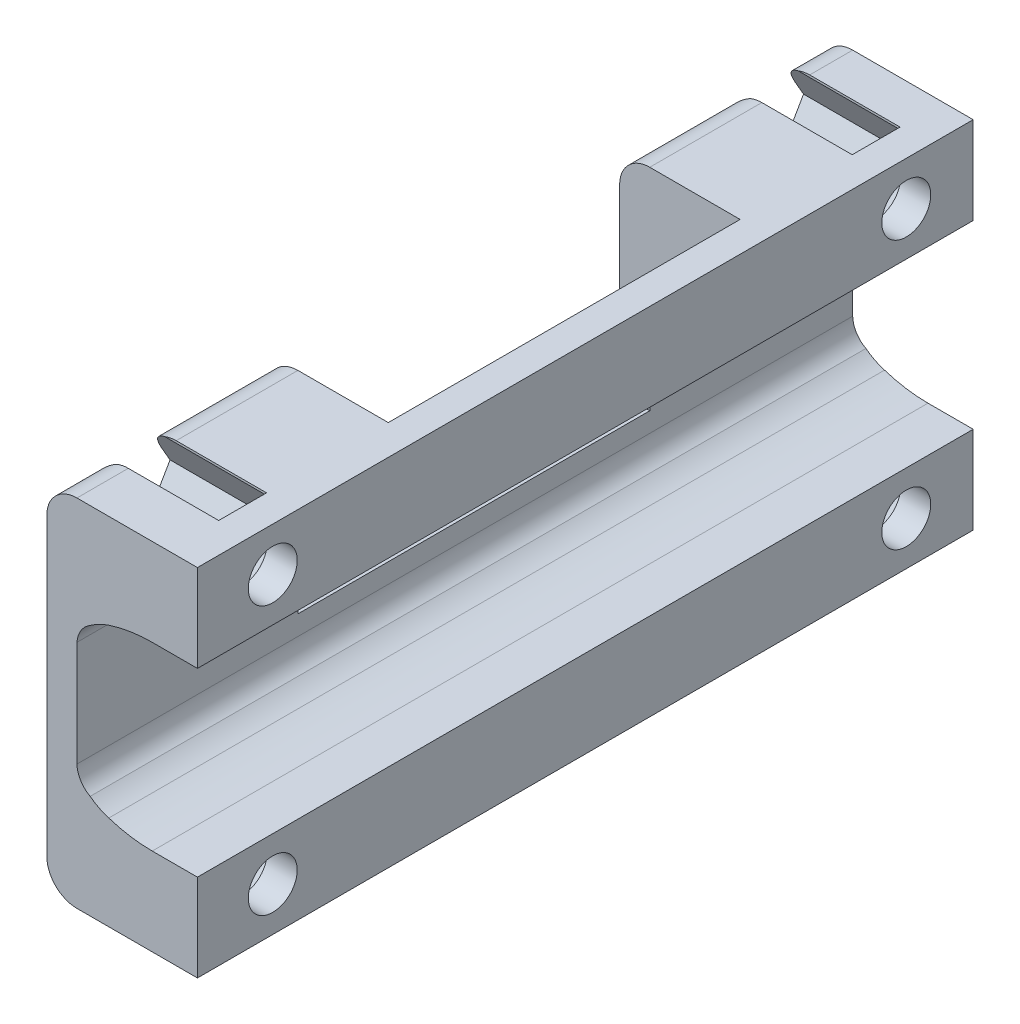
from build123d import *

# Parameters (mm, degrees)
SALIENTE_EXTRUIR1_DEPTH = 51.502837
CORTAR_EXTRUIR1_DEPTH   = 8
CROQUIS3_W              = 3.18
CROQUIS3_H              = 0.146039216
CORTAR_EXTRUIR3_DEPTH   = 8
CROQUIS4_W              = 23.359382497
CROQUIS4_H              = 14
CORTAR_EXTRUIR4_DEPTH   = 8
CORTAR_EXTRUIR5_START   = -51.502837
CORTAR_EXTRUIR5_DEPTH   = 51.502837
CROQUIS6_W              = 0.403846154
CROQUIS6_H              = 4.5
CORTAR_EXTRUIR6_DEPTH   = 1.5
CROQUIS7_R              = 1.625
CORTAR_EXTRUIR7_DEPTH   = 2


with BuildPart() as part:
    # Croquis1 → Saliente-Extruir1 (new body)
    with BuildSketch(Plane.XY):
        with BuildLine():
            Line((-16, 14), (-13, 14))
            Line((-13, 14), (-13, 8.2))
            Line((-13, 8.2), (-23, 8.2))
            Line((-23, 8.2), (-23, 31.8))
            Line((-23, 31.8), (-13, 31.8))
            Line((-13, 31.8), (-13, 26))
            Line((-13, 26), (-16, 26))
            ThreePointArc((-16, 26), (-17.460051117, 25.884841815), (-18.883995499, 25.542215094))
            ThreePointArc((-18.883995499, 25.542215094), (-19.527886573, 25.276055216), (-20.123234658, 24.91411951))
            ThreePointArc((-20.123234658, 24.91411951), (-20.731943688, 24.312663452), (-21, 23.5))
            Line((-21, 23.5), (-21, 16.5))
            ThreePointArc((-21, 16.5), (-20.754089234, 15.673606133), (-20.123234658, 15.08588049))
            ThreePointArc((-20.123234658, 15.08588049), (-19.534005924, 14.711871241), (-18.883995499, 14.457784906))
            ThreePointArc((-18.883995499, 14.457784906), (-17.460051117, 14.115158185), (-16, 14))
        make_face()
    extrude(amount=-SALIENTE_EXTRUIR1_DEPTH)

    # Croquis2 → Cortar-Extruir1 (cut)
    with BuildSketch(Plane.ZY.offset(23)):
        Polygon((-8.18, 28.9), (-6.59, 26.146039216), (-3.41, 26.146039216), (-1.82, 28.9), (-3.41, 31.653960784), (-6.59, 31.653960784), align=None)
        Polygon((-1.82, 11.1), (-3.41, 13.853960784), (-6.59, 13.853960784), (-8.18, 11.1), (-6.59, 8.346039216), (-3.41, 8.346039216), align=None)
        Polygon((-43.880216618, 28.9), (-45.470216618, 31.653960784), (-48.650216618, 31.653960784), (-50.240216618, 28.9), (-48.650216618, 26.146039216), (-45.470216618, 26.146039216), align=None)
        Polygon((-43.880216618, 11.1), (-45.470216618, 13.853960784), (-48.650216618, 13.853960784), (-50.240216618, 11.1), (-48.650216618, 8.346039216), (-45.470216618, 8.346039216), align=None)
    extrude(amount=-CORTAR_EXTRUIR1_DEPTH, mode=Mode.SUBTRACT)

    # Croquis3 → Cortar-Extruir3 (cut)
    with BuildSketch(Plane.ZY.offset(23)):
        with Locations((-47.060216618, 8.273019608)):
            Rectangle(CROQUIS3_W, CROQUIS3_H)
        with Locations((-47.060216618, 31.726980392)):
            Rectangle(CROQUIS3_W, CROQUIS3_H)
        with Locations((-5, 8.273019608)):
            Rectangle(CROQUIS3_W, CROQUIS3_H)
        with Locations((-5, 31.726980392)):
            Rectangle(CROQUIS3_W, CROQUIS3_H)
    extrude(amount=-CORTAR_EXTRUIR3_DEPTH, mode=Mode.SUBTRACT)

    # Croquis4 → Cortar-Extruir4 (cut)
    with BuildSketch(Plane.ZY.offset(23)):
        with Locations((-26.35041706, 24.8)):
            Rectangle(CROQUIS4_W, CROQUIS4_H)
    extrude(amount=-CORTAR_EXTRUIR4_DEPTH, mode=Mode.SUBTRACT)

    # Croquis5 → Cortar-Extruir5 (cut)
    with BuildSketch(Plane.XY.offset(CORTAR_EXTRUIR5_START)):
        with BuildLine():
            Line((-23, 31.8), (-21, 31.8))
            ThreePointArc((-21, 31.8), (-22.414213562, 31.214213562), (-23, 29.8))
            Line((-23, 29.8), (-23, 31.8))
        make_face()
        with BuildLine():
            Line((-23, 8.2), (-21, 8.2))
            ThreePointArc((-21, 8.2), (-22.414213562, 8.785786438), (-23, 10.2))
            Line((-23, 10.2), (-23, 8.2))
        make_face()
    extrude(amount=CORTAR_EXTRUIR5_DEPTH, mode=Mode.SUBTRACT)

    # Croquis6 → Cortar-Extruir6 (cut)
    # profile 1 of 7: a face of its own
    with BuildSketch(Plane.ZY.offset(23)):
        with BuildLine():
            Line((-40.453185232, 11.7), (-40.453185232, 16.2))
            Line((-40.453185232, 16.2), (-39.544531386, 16.2))
            add(Edge.make_bspline(
                [(-39.544531386, 16.2), (-39.46549983, 16.199430981), (-39.312811274, 16.198331641), (-39.092166699, 16.19136128), (-38.888016147, 16.179030682), (-38.701031043, 16.161069862), (-38.530698056, 16.139015962), (-38.377494131, 16.111372585), (-38.24062709, 16.078730651), (-38.156452095, 16.050900787), (-38.116646771, 16.037740385)],
                knots=[0, 0, 0, 0, 1.314313732, 2.53924729, 3.670748893, 4.714932338, 5.66265055, 6.526160246, 7.303039223, 8, 8, 8, 8], degree=3))
            add(Edge.make_bspline(
                [(-38.116646771, 16.037740385), (-38.064582106, 16.017900906), (-37.96163343, 15.978671842), (-37.815052844, 15.904670883), (-37.677063091, 15.820825467), (-37.546924191, 15.727025072), (-37.427608843, 15.620613767), (-37.314455833, 15.506111799), (-37.212094045, 15.379355362), (-37.118354807, 15.242973235), (-37.033837531, 15.098572025), (-36.960372899, 14.946426885), (-36.899360622, 14.787310474), (-36.848712188, 14.621665284), (-36.808795314, 14.449127084), (-36.781561402, 14.269494971), (-36.7635987, 14.08347887), (-36.761793491, 13.957254559), (-36.76087754, 13.893209135)],
                knots=[0, 0, 0, 0, 0.984719456, 1.947108742, 2.898477687, 3.838006223, 4.779231079, 5.722358779, 6.681677486, 7.655904652, 8.64651281, 9.637519902, 10.640069247, 11.656948941, 12.698408672, 13.768548281, 14.867775369, 16, 16, 16, 16], degree=3))
            add(Edge.make_bspline(
                [(-36.76087754, 13.893209135), (-36.761686212, 13.837587542), (-36.763279786, 13.727979385), (-36.777588906, 13.566441091), (-36.798387032, 13.40969507), (-36.830586715, 13.258487742), (-36.869675661, 13.111494319), (-36.919772427, 12.970281433), (-36.977160922, 12.833553678), (-37.044082194, 12.703159781), (-37.117549689, 12.579624016), (-37.19639193, 12.463169766), (-37.280524825, 12.355458766), (-37.370750638, 12.256164837), (-37.465903417, 12.165437664), (-37.566606127, 12.082519359), (-37.673118621, 12.00903236), (-37.784963836, 11.942088935), (-37.905404574, 11.883691335), (-38.036722116, 11.834281322), (-38.179476488, 11.793335674), (-38.333317289, 11.759173094), (-38.498510332, 11.732073705), (-38.675217574, 11.7139112), (-38.863167518, 11.701628858), (-38.992226573, 11.700553495), (-39.058653982, 11.7)],
                knots=[0, 0, 0, 0, 1.105936401, 2.179363191, 3.223086493, 4.248585256, 5.251745608, 6.245858792, 7.225916811, 8.198733463, 9.158002045, 10.082870192, 10.993790845, 11.873723703, 12.748670949, 13.606408763, 14.465103618, 15.319838547, 16.196477973, 17.123216899, 18.106603292, 19.147568657, 20.255746949, 21.433717677, 22.679120308, 24, 24, 24, 24], degree=3))
            Line((-39.058653982, 11.7), (-40.453185232, 11.7))
        make_face()
        with BuildLine():
            Line((-40.049339078, 12.161538462), (-39.532812636, 12.161538462))
            add(Edge.make_bspline(
                [(-39.532812636, 12.161538462), (-39.458590445, 12.161857443), (-39.31583399, 12.16247096), (-39.110559422, 12.167854507), (-38.923000198, 12.176651284), (-38.753129686, 12.188962098), (-38.601043797, 12.205250318), (-38.46642469, 12.223410907), (-38.349713644, 12.246036201), (-38.279090082, 12.266544577), (-38.246454463, 12.276021635)],
                knots=[0, 0, 0, 0, 1.375205317, 2.645023457, 3.804390687, 4.853969522, 5.800190428, 6.637939096, 7.370582563, 8, 8, 8, 8], degree=3))
            add(Edge.make_bspline(
                [(-38.246454463, 12.276021635), (-38.205377997, 12.290487924), (-38.124206177, 12.319074975), (-38.007359067, 12.371220539), (-37.898385776, 12.432988915), (-37.795387172, 12.501648981), (-37.699824329, 12.579622413), (-37.610564751, 12.665213684), (-37.527788149, 12.758858395), (-37.452349753, 12.860440317), (-37.384839076, 12.969327197), (-37.326376067, 13.084448554), (-37.275138384, 13.204543025), (-37.23492305, 13.3314548), (-37.203403014, 13.464049304), (-37.181076986, 13.602335864), (-37.16717234, 13.746288655), (-37.165550479, 13.844198529), (-37.164723694, 13.894110577)],
                knots=[0, 0, 0, 0, 0.998632004, 1.973411704, 2.929992603, 3.868527914, 4.809262121, 5.754881198, 6.702106254, 7.672490631, 8.653608572, 9.636854334, 10.631411391, 11.644891563, 12.686317036, 13.754757253, 14.855430412, 16, 16, 16, 16], degree=3))
            add(Edge.make_bspline(
                [(-37.164723694, 13.894110577), (-37.165383635, 13.946739337), (-37.166680094, 14.050129003), (-37.182975636, 14.201831325), (-37.206789065, 14.347735019), (-37.241225232, 14.487849842), (-37.285107791, 14.622449152), (-37.33987233, 14.750788522), (-37.402443698, 14.874223353), (-37.476890845, 14.989904681), (-37.55842518, 15.099310107), (-37.648911025, 15.199537855), (-37.746910788, 15.290816241), (-37.851355595, 15.374566786), (-37.965189008, 15.447420084), (-38.085729468, 15.512588674), (-38.214745331, 15.56789482), (-38.304504511, 15.5973105), (-38.350120328, 15.612259615)],
                knots=[0, 0, 0, 0, 1.122418816, 2.205001699, 3.251619955, 4.274784885, 5.280384055, 6.268708349, 7.249350384, 8.229342522, 9.199999885, 10.157847722, 11.105861043, 12.055065948, 13.010012805, 13.98527497, 14.976112212, 16, 16, 16, 16], degree=3))
            add(Edge.make_bspline(
                [(-38.350120328, 15.612259615), (-38.387857516, 15.622695023), (-38.468097132, 15.644883562), (-38.599033586, 15.669087612), (-38.746395921, 15.690436254), (-38.910838394, 15.708510876), (-39.092173556, 15.721480289), (-39.290540869, 15.731214836), (-39.506026075, 15.737780506), (-39.655403618, 15.738228844), (-39.732932828, 15.738461538)],
                knots=[0, 0, 0, 0, 0.674548936, 1.434276114, 2.292660221, 3.240891867, 4.284742987, 5.42552168, 6.663806718, 8, 8, 8, 8], degree=3))
            Line((-39.732932828, 15.738461538), (-40.049339078, 15.738461538))
            Line((-40.049339078, 15.738461538), (-40.049339078, 12.161538462))
        make_face(mode=Mode.SUBTRACT)
    # profile 2 of 7: a face of its own
    with BuildSketch(Plane.ZY.offset(23)):
        Polygon((-33.991646771, 16.2), (-31.914723694, 11.7), (-32.353726097, 11.7), (-33.018990521, 13.142307692), (-35.058954463, 13.142307692), (-35.743149174, 11.7), (-36.183954463, 11.7), (-34.049339078, 16.2), align=None)
        Polygon((-34.025000136, 15.322896635), (-34.839903982, 13.603846154), (-33.231730905, 13.603846154), align=None, mode=Mode.SUBTRACT)
    # profile 3 of 7: a face of its own
    with BuildSketch(Plane.ZY.offset(23)):
        Polygon((-31.337800617, 11.7), (-30.743750136, 16.2), (-30.686057828, 16.2), (-28.828185232, 12.507692308), (-26.974819847, 16.2), (-26.916226097, 16.2), (-26.318569847, 11.7), (-26.724218886, 11.7), (-27.155108309, 14.937980769), (-28.779507347, 11.7), (-28.870553021, 11.7), (-30.501262155, 14.945192308), (-30.931250136, 11.7), align=None)
    # profile 4 of 7: a face of its own
    with BuildSketch(Plane.ZY.offset(23)):
        Polygon((-23.549339078, 16.2), (-21.472416001, 11.7), (-21.911418405, 11.7), (-22.576682828, 13.142307692), (-24.616646771, 13.142307692), (-25.300841482, 11.7), (-25.741646771, 11.7), (-23.607031386, 16.2), align=None)
        Polygon((-23.582692444, 15.322896635), (-24.39759629, 13.603846154), (-22.789423213, 13.603846154), align=None, mode=Mode.SUBTRACT)
    # profile 5 of 7: a face of its own
    with BuildSketch(Plane.ZY.offset(23)):
        with BuildLine():
            Line((-21.126262155, 12.568088942), (-20.745853501, 12.796153846))
            add(Edge.make_bspline(
                [(-20.745853501, 12.796153846), (-20.710472911, 12.736928208), (-20.642685064, 12.623454172), (-20.529604745, 12.470122406), (-20.412433859, 12.339799633), (-20.290304716, 12.233243994), (-20.163962783, 12.149352569), (-20.032583285, 12.089949699), (-19.896608957, 12.052900588), (-19.804071187, 12.048400477), (-19.757872732, 12.046153846)],
                knots=[0, 0, 0, 0, 1.272034388, 2.437168799, 3.508375237, 4.49857839, 5.41946034, 6.295179144, 7.148887113, 8, 8, 8, 8], degree=3))
            add(Edge.make_bspline(
                [(-19.757872732, 12.046153846), (-19.718418197, 12.047252711), (-19.640199489, 12.049431213), (-19.525048034, 12.070363672), (-19.413214288, 12.102522124), (-19.307003182, 12.148577607), (-19.207880249, 12.204298517), (-19.120957355, 12.271600746), (-19.045812353, 12.346951582), (-18.984343491, 12.431014995), (-18.937183446, 12.521422757), (-18.900936501, 12.614220409), (-18.880821406, 12.710865711), (-18.877791294, 12.775936306), (-18.876262155, 12.808774038)],
                knots=[0, 0, 0, 0, 1.095163259, 2.171163733, 3.241058638, 4.321873601, 5.38011039, 6.391990106, 7.366004449, 8.327778327, 9.272591725, 10.192022065, 11.087607919, 12, 12, 12, 12], degree=3))
            add(Edge.make_bspline(
                [(-18.876262155, 12.808774038), (-18.878157697, 12.846240845), (-18.882011058, 12.922405388), (-18.914580104, 13.034776371), (-18.96581485, 13.145981104), (-19.013081106, 13.214768445), (-19.037620328, 13.250480769)],
                knots=[0, 0, 0, 0, 0.938893495, 1.908633276, 2.914225137, 4, 4, 4, 4], degree=3))
            add(Edge.make_bspline(
                [(-19.037620328, 13.250480769), (-19.057768261, 13.276255257), (-19.100066325, 13.330365569), (-19.172783127, 13.410909443), (-19.258110988, 13.493990268), (-19.353129844, 13.582780484), (-19.461300959, 13.673150508), (-19.579236334, 13.769409723), (-19.70994701, 13.867897465), (-19.801617791, 13.933947906), (-19.848918405, 13.968028846)],
                knots=[0, 0, 0, 0, 0.722233717, 1.516239348, 2.393582979, 3.351407094, 4.387010283, 5.505090956, 6.712668013, 8, 8, 8, 8], degree=3))
            add(Edge.make_bspline(
                [(-19.848918405, 13.968028846), (-19.896263543, 14.001751316), (-19.986783842, 14.06622611), (-20.113373447, 14.161914475), (-20.226573471, 14.249399451), (-20.325880778, 14.329504609), (-20.411251688, 14.402240815), (-20.483358931, 14.466909594), (-20.540365647, 14.525259886), (-20.57206568, 14.56311304), (-20.586298213, 14.580108173)],
                knots=[0, 0, 0, 0, 1.452282411, 2.77665338, 3.964542531, 5.026858415, 5.96415736, 6.766646006, 7.446254459, 8, 8, 8, 8], degree=3))
            add(Edge.make_bspline(
                [(-20.586298213, 14.580108173), (-20.606191485, 14.60659522), (-20.645314275, 14.658685554), (-20.696956282, 14.740103228), (-20.740849492, 14.823447427), (-20.775258204, 14.90894211), (-20.804233343, 14.995387018), (-20.823722111, 15.083910048), (-20.835925336, 15.174113986), (-20.837175033, 15.234817059), (-20.837800617, 15.265204327)],
                knots=[0, 0, 0, 0, 1.068054152, 2.10047183, 3.106115577, 4.101338837, 5.06977816, 6.043150881, 7.020423561, 8, 8, 8, 8], degree=3))
            add(Edge.make_bspline(
                [(-20.837800617, 15.265204327), (-20.836122491, 15.312814037), (-20.832802108, 15.407015833), (-20.804721443, 15.544626901), (-20.760399151, 15.676009437), (-20.698305724, 15.799862724), (-20.618260556, 15.912961842), (-20.525630017, 16.016607754), (-20.415300964, 16.103738788), (-20.294247591, 16.179868577), (-20.161746541, 16.239456196), (-20.022901094, 16.284406027), (-19.877490573, 16.309875073), (-19.779000828, 16.313530056), (-19.729026578, 16.315384615)],
                knots=[0, 0, 0, 0, 1.005424448, 1.989358655, 2.955360095, 3.929531133, 4.905563448, 5.876582895, 6.856512386, 7.866279853, 8.892233794, 9.918561126, 10.94386622, 12, 12, 12, 12], degree=3))
            add(Edge.make_bspline(
                [(-19.729026578, 16.315384615), (-19.675998449, 16.31355562), (-19.570542426, 16.309918333), (-19.415422006, 16.278292936), (-19.266072513, 16.225963501), (-19.145931173, 16.166578083), (-19.051903336, 16.107266263), (-18.980195537, 16.053240775), (-18.907530243, 15.991044207), (-18.833321316, 15.92051089), (-18.758826182, 15.840993639), (-18.682938886, 15.753037039), (-18.605481969, 15.65717861), (-18.555653006, 15.588747109), (-18.530108309, 15.553665865)],
                knots=[0, 0, 0, 0, 1.286793592, 2.559021753, 3.825965368, 5.121522368, 5.803751409, 6.523245864, 7.299691795, 8.125521123, 9.008227632, 9.944561021, 10.946284179, 12, 12, 12, 12], degree=3))
            Line((-18.530108309, 15.553665865), (-18.895192444, 15.276923077))
            add(Edge.make_bspline(
                [(-18.895192444, 15.276923077), (-18.917237214, 15.305322822), (-18.959690287, 15.36001409), (-19.024142485, 15.436605782), (-19.084890746, 15.506569827), (-19.14474126, 15.567339277), (-19.200533072, 15.62224202), (-19.254683555, 15.669247422), (-19.306413435, 15.708816044), (-19.371620892, 15.751043479), (-19.453543673, 15.79290184), (-19.556380933, 15.828322083), (-19.663849001, 15.849607163), (-19.737044242, 15.852421447), (-19.774098694, 15.853846154)],
                knots=[0, 0, 0, 0, 1.181633172, 2.275549214, 3.290209073, 4.226197932, 5.078386478, 5.862611352, 6.581680152, 7.217281963, 8.414376989, 9.595101626, 10.782541182, 12, 12, 12, 12], degree=3))
            add(Edge.make_bspline(
                [(-19.774098694, 15.853846154), (-19.820585651, 15.852288254), (-19.910231369, 15.849283991), (-20.03750453, 15.816472581), (-20.152053862, 15.764810189), (-20.250478589, 15.692405217), (-20.33242613, 15.606621084), (-20.391704577, 15.507905413), (-20.42738336, 15.398899467), (-20.431737149, 15.322860194), (-20.433954463, 15.284134615)],
                knots=[0, 0, 0, 0, 1.14458467, 2.207223713, 3.21896685, 4.227309161, 5.202851033, 6.127160689, 7.046193047, 8, 8, 8, 8], degree=3))
            add(Edge.make_bspline(
                [(-20.433954463, 15.284134615), (-20.433449014, 15.260025572), (-20.432437291, 15.211768061), (-20.418326837, 15.140473375), (-20.400199128, 15.069358796), (-20.371472887, 14.998744047), (-20.33181464, 14.927394157), (-20.279736556, 14.854080494), (-20.214148012, 14.778156869), (-20.163906139, 14.72877596), (-20.137379944, 14.702704327)],
                knots=[0, 0, 0, 0, 0.858281714, 1.717966888, 2.583508476, 3.4729293, 4.427298488, 5.488583878, 6.674047936, 8, 8, 8, 8], degree=3))
            add(Edge.make_bspline(
                [(-20.137379944, 14.702704327), (-20.127529608, 14.693913865), (-20.104127464, 14.67302974), (-20.061344131, 14.638839665), (-20.004846248, 14.596664672), (-19.936109132, 14.544480979), (-19.853865381, 14.483947671), (-19.758105952, 14.415838741), (-19.649898267, 14.337943151), (-19.573112946, 14.283483456), (-19.532512155, 14.2546875)],
                knots=[0, 0, 0, 0, 0.420754252, 0.999615792, 1.744751191, 2.668019286, 3.750313428, 4.999500688, 6.413464383, 8, 8, 8, 8], degree=3))
            add(Edge.make_bspline(
                [(-19.532512155, 14.2546875), (-19.483673124, 14.219148609), (-19.389103108, 14.150332473), (-19.254543363, 14.046940884), (-19.132537038, 13.945822324), (-19.022655776, 13.847622544), (-18.923814037, 13.753086424), (-18.837108396, 13.661076621), (-18.761655379, 13.572252313), (-18.680424955, 13.458373287), (-18.597422044, 13.318511893), (-18.526140106, 13.147154158), (-18.481193659, 12.975130317), (-18.475315996, 12.859510099), (-18.472416001, 12.802463942)],
                knots=[0, 0, 0, 0, 1.163667725, 2.253281268, 3.268753668, 4.215851969, 5.092017293, 5.902905408, 6.650798638, 7.335211899, 8.59617414, 9.77448103, 10.901945474, 12, 12, 12, 12], degree=3))
            add(Edge.make_bspline(
                [(-18.472416001, 12.802463942), (-18.473260893, 12.76212033), (-18.47493427, 12.682216551), (-18.49416973, 12.564888595), (-18.522352157, 12.45093462), (-18.564828601, 12.34176319), (-18.616672661, 12.235377066), (-18.682457837, 12.134566908), (-18.758710575, 12.037101539), (-18.846182558, 11.945579907), (-18.941898718, 11.861563369), (-19.043063468, 11.786826005), (-19.149842391, 11.724509589), (-19.261656226, 11.673658506), (-19.378530659, 11.633886841), (-19.500426381, 11.605070295), (-19.627544324, 11.587384381), (-19.713944944, 11.585548688), (-19.757872732, 11.584615385)],
                knots=[0, 0, 0, 0, 0.983748083, 1.948392443, 2.894712957, 3.844097841, 4.80183111, 5.778335162, 6.776009319, 7.81870978, 8.863265674, 9.881300176, 10.883814829, 11.87499822, 12.874611388, 13.892143829, 14.928324115, 16, 16, 16, 16], degree=3))
            add(Edge.make_bspline(
                [(-19.757872732, 11.584615385), (-19.79186103, 11.585272618), (-19.859409579, 11.586578808), (-19.95932177, 11.598126168), (-20.057215527, 11.614463873), (-20.151862461, 11.640401963), (-20.244481991, 11.671872362), (-20.334671292, 11.710621647), (-20.422474076, 11.757058049), (-20.508382397, 11.810151652), (-20.592177764, 11.871940181), (-20.673074223, 11.943906105), (-20.753726033, 12.024064611), (-20.831752685, 12.114592478), (-20.908732442, 12.214027156), (-20.98314754, 12.323298963), (-21.05653832, 12.441812704), (-21.102586778, 12.525210671), (-21.126262155, 12.568088942)],
                knots=[0, 0, 0, 0, 0.915332311, 1.819136955, 2.706846663, 3.586547465, 4.459518054, 5.340707479, 6.227863349, 7.133153174, 8.059268498, 9.028702269, 10.047606654, 11.120612155, 12.245963614, 13.433783089, 14.680604001, 16, 16, 16, 16], degree=3))
        make_face()
    # profile 6 of 7: a face of its own
    with BuildSketch(Plane.ZY.offset(23)):
        Polygon((-17.549339078, 16.2), (-17.145492924, 16.2), (-17.145492924, 14.353846154), (-14.837800617, 14.353846154), (-14.837800617, 16.2), (-14.433954463, 16.2), (-14.433954463, 11.7), (-14.837800617, 11.7), (-14.837800617, 13.892307692), (-17.145492924, 13.892307692), (-17.145492924, 11.7), (-17.549339078, 11.7), align=None)
    # profile 7 of 7: a face of its own
    with BuildSketch(Plane.ZY.offset(23)):
        with Locations((-13.078185232, 13.95)):
            Rectangle(CROQUIS6_W, CROQUIS6_H)
    extrude(amount=-CORTAR_EXTRUIR6_DEPTH, mode=Mode.SUBTRACT)

    # Croquis7 → Cortar-Extruir7 (cut)
    with BuildSketch(Plane.ZY.offset(15)):
        with Locations((-47.060216618, 11.1)):
            Circle(CROQUIS7_R)
        with Locations((-5, 11.1)):
            Circle(CROQUIS7_R)
        with Locations((-47.060216618, 28.9)):
            Circle(CROQUIS7_R)
        with Locations((-5, 28.9)):
            Circle(CROQUIS7_R)
    extrude(amount=-CORTAR_EXTRUIR7_DEPTH, mode=Mode.SUBTRACT)


solid = part.part
